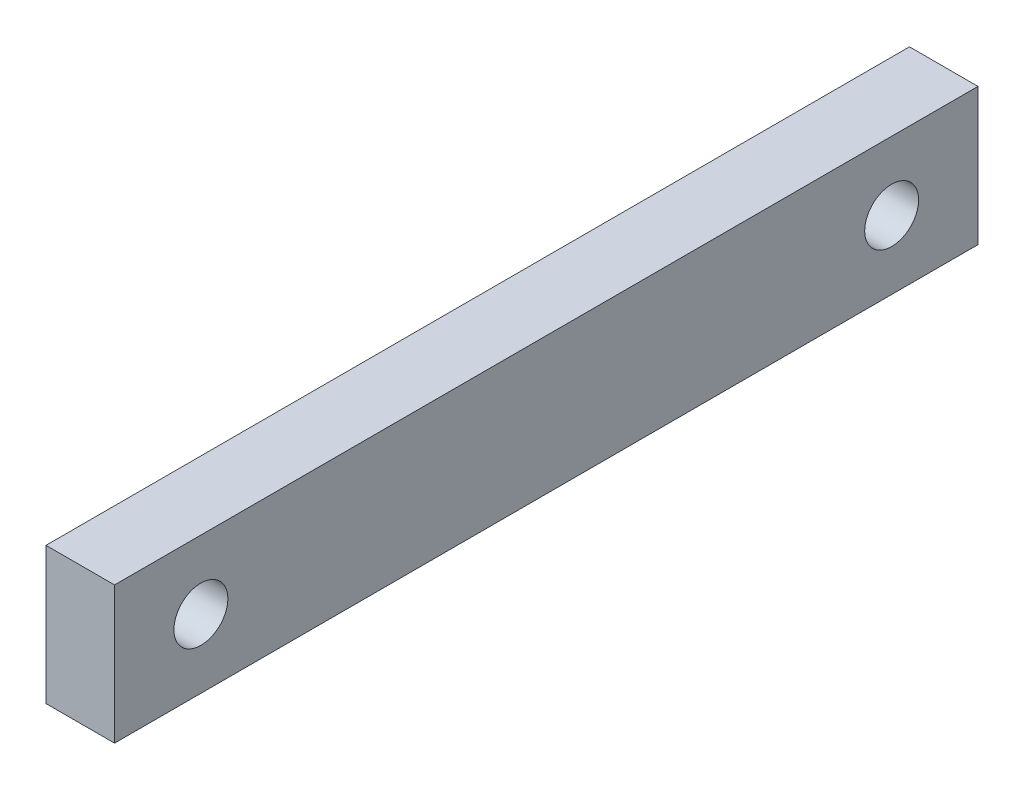
from build123d import *

# Parameters (mm, degrees)
BOSS_EXTRUDE1_DEPTH      = 40
BOSS_EXTRUDE1_DEPTH_BACK = 40
SKETCH2_W                = 6.35
SKETCH2_H                = 12.7
SKETCH4_R                = 2.5
CUT_EXTRUDE1_DEPTH       = 41.995670503


with BuildPart() as part:
    # Sketch2 → Boss-Extrude1 (new, two sides: drawn at the far end of the back side and taken through both)
    with BuildSketch(Plane.XY.offset(-BOSS_EXTRUDE1_DEPTH_BACK)):
        Rectangle(SKETCH2_W, SKETCH2_H)
    extrude(amount=BOSS_EXTRUDE1_DEPTH + BOSS_EXTRUDE1_DEPTH_BACK)

    # Sketch4 → Cut-Extrude1 (cut, through all)
    with BuildSketch(Plane(origin=(3.175, 0, 0), x_dir=(0, 0, -1), z_dir=(1, 0, 0))):
        with Locations((-32, 0)):
            Circle(SKETCH4_R)
        with Locations((32, 0)):
            Circle(SKETCH4_R)
    extrude(amount=-CUT_EXTRUDE1_DEPTH, mode=Mode.SUBTRACT)


solid = part.part
